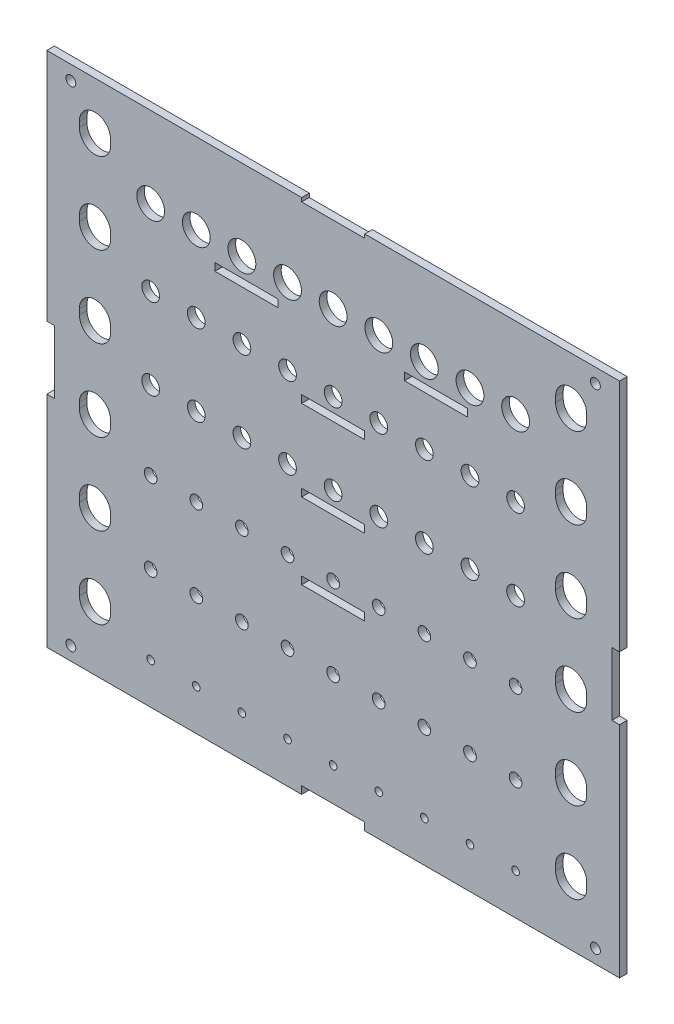
from build123d import *

# Parameters (mm, degrees)
SKETCH_1_W          = 230
SKETCH_1_H          = 230
SKETCH_1_R          = 1.95
SKETCH_1_R_2        = 5.489682629
SKETCH_1_R_3        = 3.5
SKETCH_1_R_4        = 2.5
SKETCH_1_R_5        = 1.5
EXTRUDE_1_DEPTH     = 3
SKETCH_2_W          = 24.85
SKETCH_2_H          = 3
SKETCH_2_W_2        = 24.9
SKETCH_2_W_3        = 3
SKETCH_2_H_2        = 24.9
SKETCH_2_H_3        = 1.5
CUT_EXTRUDE_1_DEPTH = 10


with BuildPart() as part:
    # Эскиз1 → Бобышка-Вытянуть1 (new body)
    with BuildSketch(Plane.XY):
        with Locations((-16.876691381, -2.67171908)):
            Rectangle(SKETCH_1_W, SKETCH_1_H)
        with Locations((-120.403614458, 93.688598292)):
            Circle(SKETCH_1_R, mode=Mode.SUBTRACT)
        with Locations((86.596385542, 93.688598292)):
            Circle(SKETCH_1_R, mode=Mode.SUBTRACT)
        with Locations((86.596385542, -99.311401708)):
            Circle(SKETCH_1_R, mode=Mode.SUBTRACT)
        with Locations((-120.403614458, -99.311401708)):
            Circle(SKETCH_1_R, mode=Mode.SUBTRACT)
        with Locations((-88.903614458, 67.488598292)):
            Circle(SKETCH_1_R_2, mode=Mode.SUBTRACT)
        with Locations((-88.903614458, 5.488598292)):
            Circle(SKETCH_1_R_3, mode=Mode.SUBTRACT)
        with Locations((-88.903614458, -57.511401708)):
            Circle(SKETCH_1_R_4, mode=Mode.SUBTRACT)
        with Locations((-88.903614458, -88.511401708)):
            Circle(SKETCH_1_R_5, mode=Mode.SUBTRACT)
        with Locations((-88.903614458, 37.488598292)):
            Circle(SKETCH_1_R_3, mode=Mode.SUBTRACT)
        with Locations((-88.903614458, -25.511401708)):
            Circle(SKETCH_1_R_4, mode=Mode.SUBTRACT)
        with Locations((-70.903614458, 67.488598292)):
            Circle(SKETCH_1_R_2, mode=Mode.SUBTRACT)
        with Locations((-70.903614458, 5.488598292)):
            Circle(SKETCH_1_R_3, mode=Mode.SUBTRACT)
        with Locations((-70.903614458, -57.511401708)):
            Circle(SKETCH_1_R_4, mode=Mode.SUBTRACT)
        with Locations((-70.903614458, -88.511401708)):
            Circle(SKETCH_1_R_5, mode=Mode.SUBTRACT)
        with Locations((-70.903614458, 37.488598292)):
            Circle(SKETCH_1_R_3, mode=Mode.SUBTRACT)
        with Locations((-70.903614458, -25.511401708)):
            Circle(SKETCH_1_R_4, mode=Mode.SUBTRACT)
        with Locations((-52.903614458, 67.488598292)):
            Circle(SKETCH_1_R_2, mode=Mode.SUBTRACT)
        with Locations((-52.903614458, 5.488598292)):
            Circle(SKETCH_1_R_3, mode=Mode.SUBTRACT)
        with Locations((-52.903614458, -57.511401708)):
            Circle(SKETCH_1_R_4, mode=Mode.SUBTRACT)
        with Locations((-52.903614458, -88.511401708)):
            Circle(SKETCH_1_R_5, mode=Mode.SUBTRACT)
        with Locations((-52.903614458, 37.488598292)):
            Circle(SKETCH_1_R_3, mode=Mode.SUBTRACT)
        with Locations((-52.903614458, -25.511401708)):
            Circle(SKETCH_1_R_4, mode=Mode.SUBTRACT)
        with Locations((-34.903614458, 67.488598292)):
            Circle(SKETCH_1_R_2, mode=Mode.SUBTRACT)
        with Locations((-34.903614458, 5.488598292)):
            Circle(SKETCH_1_R_3, mode=Mode.SUBTRACT)
        with Locations((-34.903614458, -57.511401708)):
            Circle(SKETCH_1_R_4, mode=Mode.SUBTRACT)
        with Locations((-34.903614458, -88.511401708)):
            Circle(SKETCH_1_R_5, mode=Mode.SUBTRACT)
        with Locations((-34.903614458, 37.488598292)):
            Circle(SKETCH_1_R_3, mode=Mode.SUBTRACT)
        with Locations((-34.903614458, -25.511401708)):
            Circle(SKETCH_1_R_4, mode=Mode.SUBTRACT)
        with Locations((-16.903614458, 67.488598292)):
            Circle(SKETCH_1_R_2, mode=Mode.SUBTRACT)
        with Locations((-16.903614458, 5.488598292)):
            Circle(SKETCH_1_R_3, mode=Mode.SUBTRACT)
        with Locations((-16.903614458, -57.511401708)):
            Circle(SKETCH_1_R_4, mode=Mode.SUBTRACT)
        with Locations((-16.903614458, -88.511401708)):
            Circle(SKETCH_1_R_5, mode=Mode.SUBTRACT)
        with Locations((-16.903614458, 37.488598292)):
            Circle(SKETCH_1_R_3, mode=Mode.SUBTRACT)
        with Locations((-16.903614458, -25.511401708)):
            Circle(SKETCH_1_R_4, mode=Mode.SUBTRACT)
        with Locations((1.096385542, 67.488598292)):
            Circle(SKETCH_1_R_2, mode=Mode.SUBTRACT)
        with Locations((1.096385542, 5.488598292)):
            Circle(SKETCH_1_R_3, mode=Mode.SUBTRACT)
        with Locations((1.096385542, -57.511401708)):
            Circle(SKETCH_1_R_4, mode=Mode.SUBTRACT)
        with Locations((1.096385542, -88.511401708)):
            Circle(SKETCH_1_R_5, mode=Mode.SUBTRACT)
        with Locations((1.096385542, 37.488598292)):
            Circle(SKETCH_1_R_3, mode=Mode.SUBTRACT)
        with Locations((1.096385542, -25.511401708)):
            Circle(SKETCH_1_R_4, mode=Mode.SUBTRACT)
        with Locations((19.096385542, 67.488598292)):
            Circle(SKETCH_1_R_2, mode=Mode.SUBTRACT)
        with Locations((19.096385542, 5.488598292)):
            Circle(SKETCH_1_R_3, mode=Mode.SUBTRACT)
        with Locations((19.096385542, -57.511401708)):
            Circle(SKETCH_1_R_4, mode=Mode.SUBTRACT)
        with Locations((19.096385542, -88.511401708)):
            Circle(SKETCH_1_R_5, mode=Mode.SUBTRACT)
        with Locations((19.096385542, 37.488598292)):
            Circle(SKETCH_1_R_3, mode=Mode.SUBTRACT)
        with Locations((19.096385542, -25.511401708)):
            Circle(SKETCH_1_R_4, mode=Mode.SUBTRACT)
        with Locations((37.096385542, 67.488598292)):
            Circle(SKETCH_1_R_2, mode=Mode.SUBTRACT)
        with Locations((37.096385542, 5.488598292)):
            Circle(SKETCH_1_R_3, mode=Mode.SUBTRACT)
        with Locations((37.096385542, -57.511401708)):
            Circle(SKETCH_1_R_4, mode=Mode.SUBTRACT)
        with Locations((37.096385542, -88.511401708)):
            Circle(SKETCH_1_R_5, mode=Mode.SUBTRACT)
        with Locations((37.096385542, 37.488598292)):
            Circle(SKETCH_1_R_3, mode=Mode.SUBTRACT)
        with Locations((37.096385542, -25.511401708)):
            Circle(SKETCH_1_R_4, mode=Mode.SUBTRACT)
        with Locations((55.096385542, 67.488598292)):
            Circle(SKETCH_1_R_2, mode=Mode.SUBTRACT)
        with Locations((55.096385542, 5.488598292)):
            Circle(SKETCH_1_R_3, mode=Mode.SUBTRACT)
        with Locations((55.096385542, -57.511401708)):
            Circle(SKETCH_1_R_4, mode=Mode.SUBTRACT)
        with Locations((55.096385542, -88.511401708)):
            Circle(SKETCH_1_R_5, mode=Mode.SUBTRACT)
        with Locations((55.096385542, 37.488598292)):
            Circle(SKETCH_1_R_3, mode=Mode.SUBTRACT)
        with Locations((55.096385542, -25.511401708)):
            Circle(SKETCH_1_R_4, mode=Mode.SUBTRACT)
        with BuildLine():
            Line((83.173308619, 81.568598292), (83.173308619, 79.368598292))
            ThreePointArc((83.173308619, 79.368598292), (77.023308619, 73.218598292), (70.873308619, 79.368598292))
            Line((70.873308619, 79.368598292), (70.873308619, 81.568598292))
            ThreePointArc((70.873308619, 81.568598292), (77.023308619, 87.718598292), (83.173308619, 81.568598292))
        make_face(mode=Mode.SUBTRACT)
        with BuildLine():
            Line((-104.726691381, 81.568598292), (-104.726691381, 79.368598292))
            ThreePointArc((-104.726691381, 79.368598292), (-110.876691381, 73.218598292), (-117.026691381, 79.368598292))
            Line((-117.026691381, 79.368598292), (-117.026691381, 81.568598292))
            ThreePointArc((-117.026691381, 81.568598292), (-110.876691381, 87.718598292), (-104.726691381, 81.568598292))
        make_face(mode=Mode.SUBTRACT)
        with BuildLine():
            Line((83.173308619, 49.568598292), (83.173308619, 47.368598292))
            ThreePointArc((83.173308619, 47.368598292), (77.023308619, 41.218598292), (70.873308619, 47.368598292))
            Line((70.873308619, 47.368598292), (70.873308619, 49.568598292))
            ThreePointArc((70.873308619, 49.568598292), (77.023308619, 55.718598292), (83.173308619, 49.568598292))
        make_face(mode=Mode.SUBTRACT)
        with BuildLine():
            Line((-104.726691381, 49.568598292), (-104.726691381, 47.368598292))
            ThreePointArc((-104.726691381, 47.368598292), (-110.876691381, 41.218598292), (-117.026691381, 47.368598292))
            Line((-117.026691381, 47.368598292), (-117.026691381, 49.568598292))
            ThreePointArc((-117.026691381, 49.568598292), (-110.876691381, 55.718598292), (-104.726691381, 49.568598292))
        make_face(mode=Mode.SUBTRACT)
        with BuildLine():
            Line((83.173308619, 17.568598292), (83.173308619, 15.368598292))
            ThreePointArc((83.173308619, 15.368598292), (77.023308619, 9.218598292), (70.873308619, 15.368598292))
            Line((70.873308619, 15.368598292), (70.873308619, 17.568598292))
            ThreePointArc((70.873308619, 17.568598292), (77.023308619, 23.718598292), (83.173308619, 17.568598292))
        make_face(mode=Mode.SUBTRACT)
        with BuildLine():
            Line((-104.726691381, 17.568598292), (-104.726691381, 15.368598292))
            ThreePointArc((-104.726691381, 15.368598292), (-110.876691381, 9.218598292), (-117.026691381, 15.368598292))
            Line((-117.026691381, 15.368598292), (-117.026691381, 17.568598292))
            ThreePointArc((-117.026691381, 17.568598292), (-110.876691381, 23.718598292), (-104.726691381, 17.568598292))
        make_face(mode=Mode.SUBTRACT)
        with BuildLine():
            Line((83.173308619, -14.431401708), (83.173308619, -16.631401708))
            ThreePointArc((83.173308619, -16.631401708), (77.023308619, -22.781401708), (70.873308619, -16.631401708))
            Line((70.873308619, -16.631401708), (70.873308619, -14.431401708))
            ThreePointArc((70.873308619, -14.431401708), (77.023308619, -8.281401708), (83.173308619, -14.431401708))
        make_face(mode=Mode.SUBTRACT)
        with BuildLine():
            Line((-104.726691381, -14.431401708), (-104.726691381, -16.631401708))
            ThreePointArc((-104.726691381, -16.631401708), (-110.876691381, -22.781401708), (-117.026691381, -16.631401708))
            Line((-117.026691381, -16.631401708), (-117.026691381, -14.431401708))
            ThreePointArc((-117.026691381, -14.431401708), (-110.876691381, -8.281401708), (-104.726691381, -14.431401708))
        make_face(mode=Mode.SUBTRACT)
        with BuildLine():
            Line((83.173308619, -46.431401708), (83.173308619, -48.631401708))
            ThreePointArc((83.173308619, -48.631401708), (77.023308619, -54.781401708), (70.873308619, -48.631401708))
            Line((70.873308619, -48.631401708), (70.873308619, -46.431401708))
            ThreePointArc((70.873308619, -46.431401708), (77.023308619, -40.281401708), (83.173308619, -46.431401708))
        make_face(mode=Mode.SUBTRACT)
        with BuildLine():
            Line((-104.726691381, -46.431401708), (-104.726691381, -48.631401708))
            ThreePointArc((-104.726691381, -48.631401708), (-110.876691381, -54.781401708), (-117.026691381, -48.631401708))
            Line((-117.026691381, -48.631401708), (-117.026691381, -46.431401708))
            ThreePointArc((-117.026691381, -46.431401708), (-110.876691381, -40.281401708), (-104.726691381, -46.431401708))
        make_face(mode=Mode.SUBTRACT)
        with BuildLine():
            Line((83.173308619, -78.431401708), (83.173308619, -80.631401708))
            ThreePointArc((83.173308619, -80.631401708), (77.023308619, -86.781401708), (70.873308619, -80.631401708))
            Line((70.873308619, -80.631401708), (70.873308619, -78.431401708))
            ThreePointArc((70.873308619, -78.431401708), (77.023308619, -72.281401708), (83.173308619, -78.431401708))
        make_face(mode=Mode.SUBTRACT)
        with BuildLine():
            Line((-104.726691381, -78.431401708), (-104.726691381, -80.631401708))
            ThreePointArc((-104.726691381, -80.631401708), (-110.876691381, -86.781401708), (-117.026691381, -80.631401708))
            Line((-117.026691381, -80.631401708), (-117.026691381, -78.431401708))
            ThreePointArc((-117.026691381, -78.431401708), (-110.876691381, -72.281401708), (-104.726691381, -78.431401708))
        make_face(mode=Mode.SUBTRACT)
    extrude(amount=EXTRUDE_1_DEPTH)

    # Эскиз2 → Вырез-Вытянуть1 (cut)
    # profile 1 of 10: a face of its own
    with BuildSketch(Plane.XY.offset(3)):
        Polygon((-124.903614458, 112.32828092), (-131.876691381, 112.32828092), (-131.876691381, 99.188598292), (-131.876691381, -104.811401708), (-131.876691381, -117.67171908), (-124.903614458, -117.67171908), (91.096385542, -117.67171908), (98.123308619, -117.67171908), (98.123308619, -104.811401708), (98.123308619, 99.188598292), (98.123308619, 112.32828092), (91.096385542, 112.32828092), align=None)
        Polygon((-129.876691381, 6.77828092), (-129.876691381, 99.32828092), (-29.326691381, 99.32828092), (-4.426691381, 99.32828092), (96.123308619, 99.32828092), (96.123308619, 6.77828092), (96.123308619, -18.12171908), (96.123308619, -104.67171908), (-4.426691381, -104.67171908), (-29.326691381, -104.67171908), (-129.876691381, -104.67171908), (-129.876691381, -18.12171908), align=None, mode=Mode.SUBTRACT)
    # profile 2 of 10: a face of its own
    with BuildSketch(Plane.XY.offset(3)):
        with Locations((23.698308619, 58.498915663)):
            Rectangle(SKETCH_2_W, SKETCH_2_H)
    # profile 3 of 10: a face of its own
    with BuildSketch(Plane.XY.offset(3)):
        with Locations((-16.876691381, -1.511401708)):
            Rectangle(SKETCH_2_W_2, SKETCH_2_H)
    # profile 4 of 10: a face of its own
    with BuildSketch(Plane.XY.offset(3)):
        with Locations((-128.376691381, -5.67171908)):
            Rectangle(SKETCH_2_W_3, SKETCH_2_H_2)
    # profile 5 of 10: a face of its own
    with BuildSketch(Plane.XY.offset(3)):
        with Locations((-51.151691381, 58.498915663)):
            Rectangle(SKETCH_2_W, SKETCH_2_H)
    # profile 6 of 10: a face of its own
    with BuildSketch(Plane.XY.offset(3)):
        with Locations((-16.876691381, 98.57828092)):
            Rectangle(SKETCH_2_W_2, SKETCH_2_H_3)
    # profile 7 of 10: a face of its own
    with BuildSketch(Plane.XY.offset(3)):
        with Locations((-16.876691381, 30.488598292)):
            Rectangle(SKETCH_2_W_2, SKETCH_2_H)
    # profile 8 of 10: a face of its own
    with BuildSketch(Plane.XY.offset(3)):
        with Locations((-16.876691381, -31.511401708)):
            Rectangle(SKETCH_2_W_2, SKETCH_2_H)
    # profile 9 of 10: a face of its own
    with BuildSketch(Plane.XY.offset(3)):
        with Locations((94.623308619, -5.67171908)):
            Rectangle(SKETCH_2_W_3, SKETCH_2_H_2)
    # profile 10 of 10: a face of its own
    with BuildSketch(Plane.XY.offset(3)):
        with Locations((-16.876691381, -103.17171908)):
            Rectangle(SKETCH_2_W_2, SKETCH_2_H)
    extrude(amount=-CUT_EXTRUDE_1_DEPTH, mode=Mode.SUBTRACT)


solid = part.part
